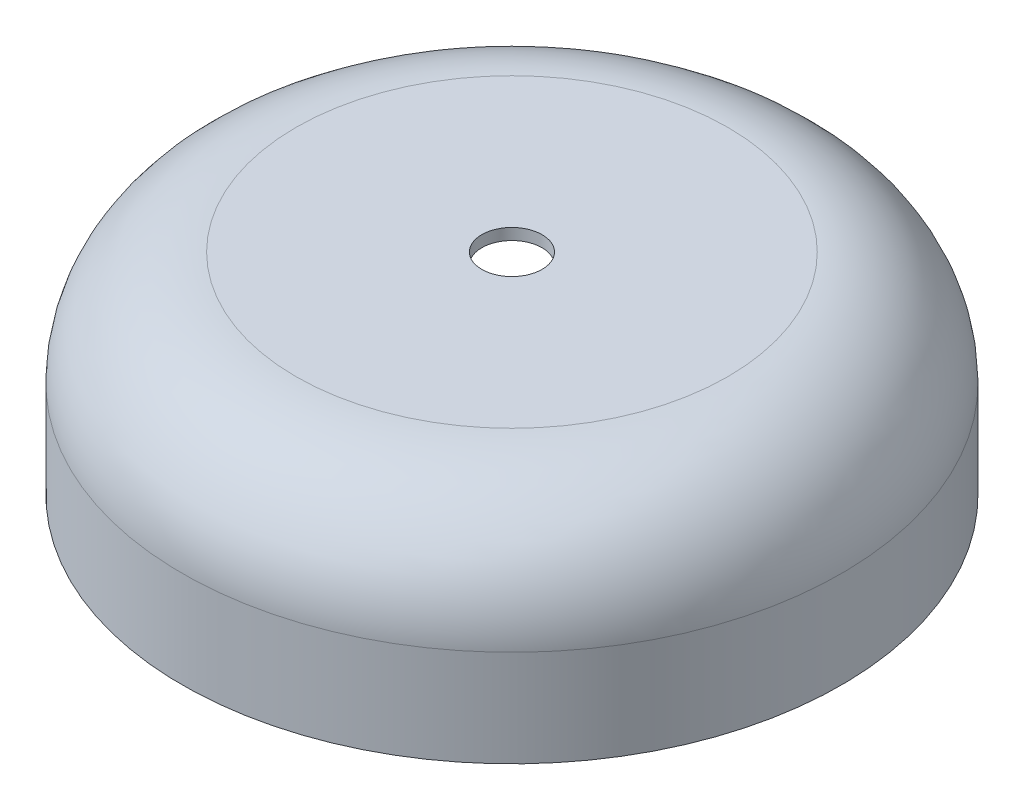
from build123d import *

# Parameters (mm, degrees)
SKETCH2_R          = 2.65
CUT_EXTRUDE1_DEPTH = 45.991665959


with BuildPart() as part:
    # Sketch1 → Revolve-Thin1 (revolve)
    with BuildSketch(Plane.XY, mode=Mode.PRIVATE) as revolve_thin1_sk:
        with BuildLine():
            Line((0, 18.5), (-19, 18.5))
            ThreePointArc((-19, 18.5), (-26.071067812, 15.571067812), (-29, 8.5))
            Line((-29, 8.5), (-29, 0))
            Line((-29, 0), (-28, 0))
            Line((-28, 0), (-28, 8.5))
            ThreePointArc((-28, 8.5), (-25.363961031, 14.863961031), (-19, 17.5))
            Line((-19, 17.5), (0, 17.5))
            Line((0, 17.5), (0, 18.5))
        make_face()
    revolve(revolve_thin1_sk.sketch.rotate(Axis((0, 0, 0), (0, 1, 0)), 270), axis=Axis((0, 0, 0), (0, 1, 0)))

    # Sketch2 → Cut-Extrude1 (cut, through all)
    with BuildSketch(Plane(origin=(0, 18.5, 0), x_dir=(1, 0, 0), z_dir=(0, 1, 0))):
        with Locations(Location((0, 0, 0), (0, 0, 270))):
            Circle(SKETCH2_R)
    extrude(amount=-CUT_EXTRUDE1_DEPTH, mode=Mode.SUBTRACT)


solid = part.part
